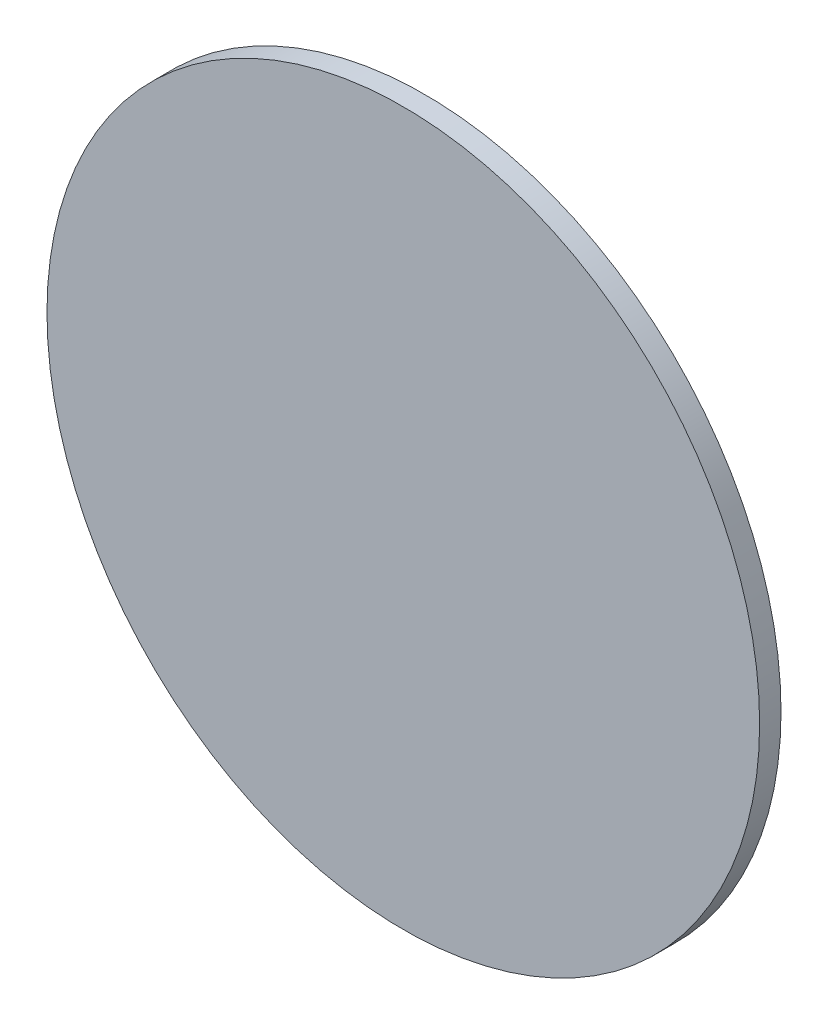
from build123d import *

# Parameters (mm, degrees)
SKETCH_1_R      = 50
EXTRUDE_1_DEPTH = 3


with BuildPart() as part:
    # 草圖1 → 填料-伸長1 (new body)
    with BuildSketch(Plane.XY):
        Circle(SKETCH_1_R)
    extrude(amount=EXTRUDE_1_DEPTH)


solid = part.part
